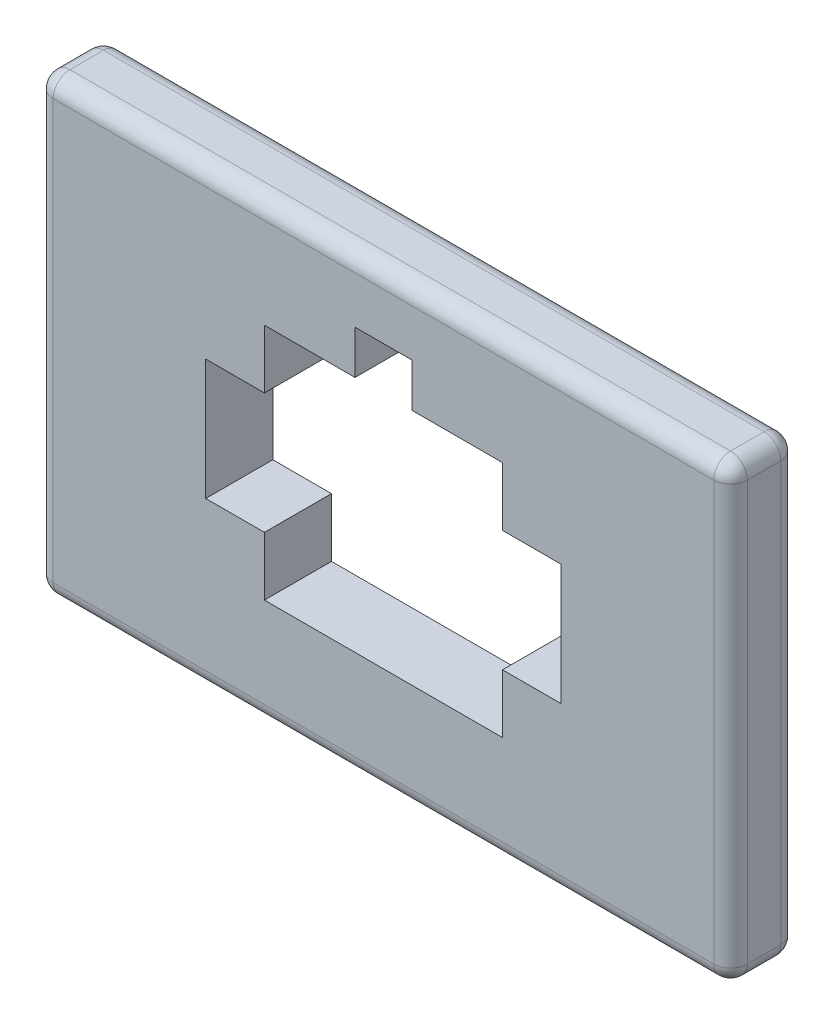
from build123d import *

# Parameters (mm, degrees)
SKETCH1_W           = 20.7
SKETCH1_H           = 13.5
BOSS_EXTRUDE1_DEPTH = 2
FILLET1_R           = 0.5
SKETCH2_W           = 10.6
SKETCH2_H           = 3.6
SKETCH2_W_2         = 7.1
SKETCH2_H_2         = 7.1
SKETCH2_W_3         = 1.7
SKETCH2_H_3         = 4.85
CUT_EXTRUDE1_DEPTH  = 13.517387906


with BuildPart() as part:
    # Sketch1 → Boss-Extrude1 (new body)
    with BuildSketch(Plane.XY):
        Rectangle(SKETCH1_W, SKETCH1_H)
    extrude(amount=BOSS_EXTRUDE1_DEPTH)

    # Fillet1
    fillet1_edges = [part.edges().sort_by_distance(p)[0] for p in [
        (-10.35, 0, 2),
        (0, -6.75, 2),
        (10.35, 0, 2),
        (0, -6.75, 0),
        (-10.35, 0, 0),
        (0, 6.75, 0),
        (10.35, 0, 0),
        (10.35, -6.75, 1),
        (-10.35, -6.75, 1),
        (-10.35, 6.75, 1),
        (10.35, 6.75, 1),
        (0, 6.75, 2),
    ]]
    fillet(fillet1_edges, radius=FILLET1_R)

    # Sketch2 → Cut-Extrude1 (cut, through all)
    with BuildSketch(Plane.XY.offset(2)):
        Rectangle(SKETCH2_W, SKETCH2_H)
        Rectangle(SKETCH2_W_2, SKETCH2_H_2)
        with Locations((0, 2.425)):
            Rectangle(SKETCH2_W_3, SKETCH2_H_3)
    extrude(amount=-CUT_EXTRUDE1_DEPTH, mode=Mode.SUBTRACT)


solid = part.part
